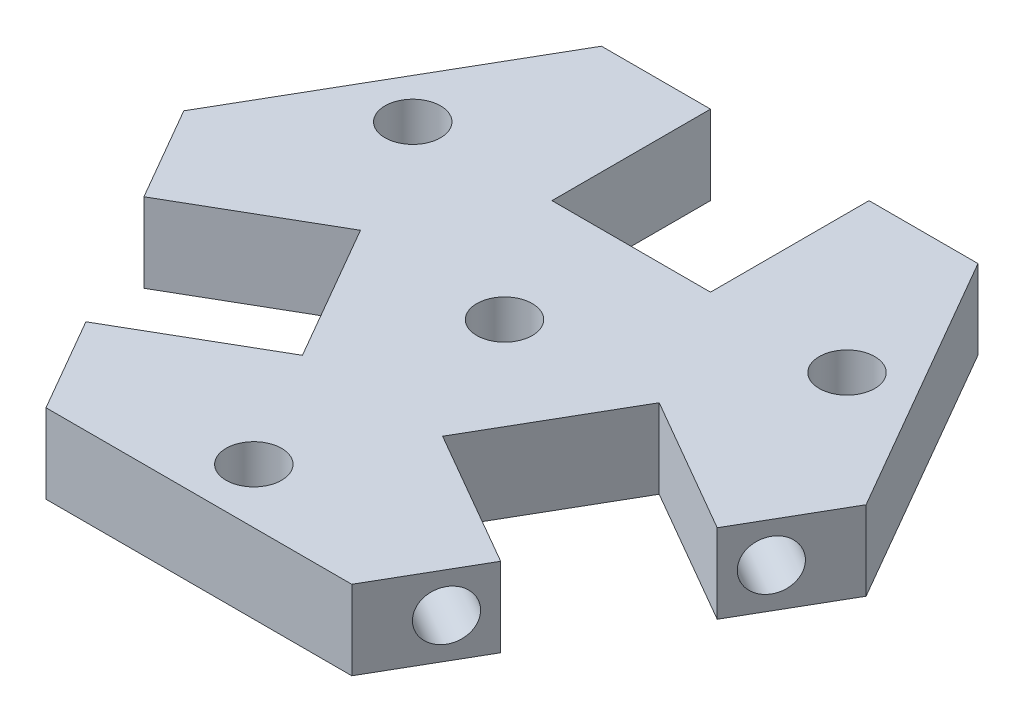
from build123d import *

# Parameters (mm, degrees)
SKETCH1_R           = 2.2225
BOSS_EXTRUDE3_DEPTH = 6.35
CUT_EXTRUDE1_DEPTH  = 6.35
SKETCH3_R           = 2.00025
CUT_EXTRUDE2_DEPTH  = 6.35
SKETCH4_R           = 2.00025
CUT_EXTRUDE3_DEPTH  = 6.35


with BuildPart() as part:
    # Sketch1 → Boss-Extrude3 (new body)
    with BuildSketch(Plane(origin=(0, 0, 0), x_dir=(1, 0, 0), z_dir=(0, 1, 0))):
        Polygon((-6.35, 10.15), (-6.35, 22.85), (-15.08, 22.85), (-27.328680476, 1.634663089), (-22.963680476, -5.925738686), (-11.965157848, 0.424261314), (-5.615157848, -10.574261314), (-16.613680476, -16.924261314), (-12.248680476, -24.484663089), (12.248680476, -24.484663089), (16.613680476, -16.924261314), (5.615157848, -10.574261314), (11.965157848, 0.424261314), (22.963680476, -5.925738686), (27.328680476, 1.634663089), (15.08, 22.85), (6.35, 22.85), (6.35, 10.15), align=None)
        with Locations(Location((0, -20.085254038, 0), (0, 0, 270))):
            Circle(SKETCH1_R, mode=Mode.SUBTRACT)
        with Locations(Location((17.394340238, 10.042627019, 0), (0, 0, 270))):
            Circle(SKETCH1_R, mode=Mode.SUBTRACT)
        with Locations(Location((-17.394340238, 10.042627019, 0), (0, 0, 270))):
            Circle(SKETCH1_R, mode=Mode.SUBTRACT)
        with Locations(Location((0, 0, 0), (0, 0, 270))):
            Circle(SKETCH1_R, mode=Mode.SUBTRACT)
    extrude(amount=BOSS_EXTRUDE3_DEPTH)

    # Sketch2 → Cut-Extrude1 (cut)
    with BuildSketch(Plane(origin=(19.788680476, 0, 11.425), x_dir=(0.5000000000000057, 0, -0.8660254037844354), z_dir=(0.8660254037844354, 0, 0.5000000000000057))):
        with BuildLine():
            ThreePointArc((-11.52525, 3.175), (-9.525, 1.17475), (-7.52475, 3.175))
            Line((-7.52475, 3.175), (-11.52525, 3.175))
        make_face()
        with BuildLine():
            Line((-11.52525, 3.175), (-7.52475, 3.175))
            ThreePointArc((-7.52475, 3.175), (-9.525, 5.17525), (-11.52525, 3.175))
        make_face()
        with BuildLine():
            ThreePointArc((7.52475, 3.175), (9.525, 1.17475), (11.52525, 3.175))
            Line((11.52525, 3.175), (7.52475, 3.175))
        make_face()
        with BuildLine():
            Line((7.52475, 3.175), (11.52525, 3.175))
            ThreePointArc((11.52525, 3.175), (9.525, 5.17525), (7.52475, 3.175))
        make_face()
    extrude(amount=-CUT_EXTRUDE1_DEPTH, mode=Mode.SUBTRACT)

    # Sketch3 → Cut-Extrude2 (cut)
    with BuildSketch(Plane(origin=(-19.788680476, 0, 11.425), x_dir=(0.5000000000000099, 0, 0.866025403784433), z_dir=(-0.8660254037844329, 0, 0.5000000000000098))):
        with Locations((-9.525, 3.175)):
            Circle(SKETCH3_R)
        with Locations((9.525, 3.175)):
            Circle(SKETCH3_R)
    extrude(amount=-CUT_EXTRUDE2_DEPTH, mode=Mode.SUBTRACT)

    # Sketch4 → Cut-Extrude3 (cut)
    with BuildSketch(Plane(origin=(0, 0, -22.85), x_dir=(-1, 0, 0), z_dir=(0, 0, -1))):
        with Locations((-9.525, 3.175)):
            Circle(SKETCH4_R)
        with Locations((9.525, 3.175)):
            Circle(SKETCH4_R)
    extrude(amount=-CUT_EXTRUDE3_DEPTH, mode=Mode.SUBTRACT)


solid = part.part
